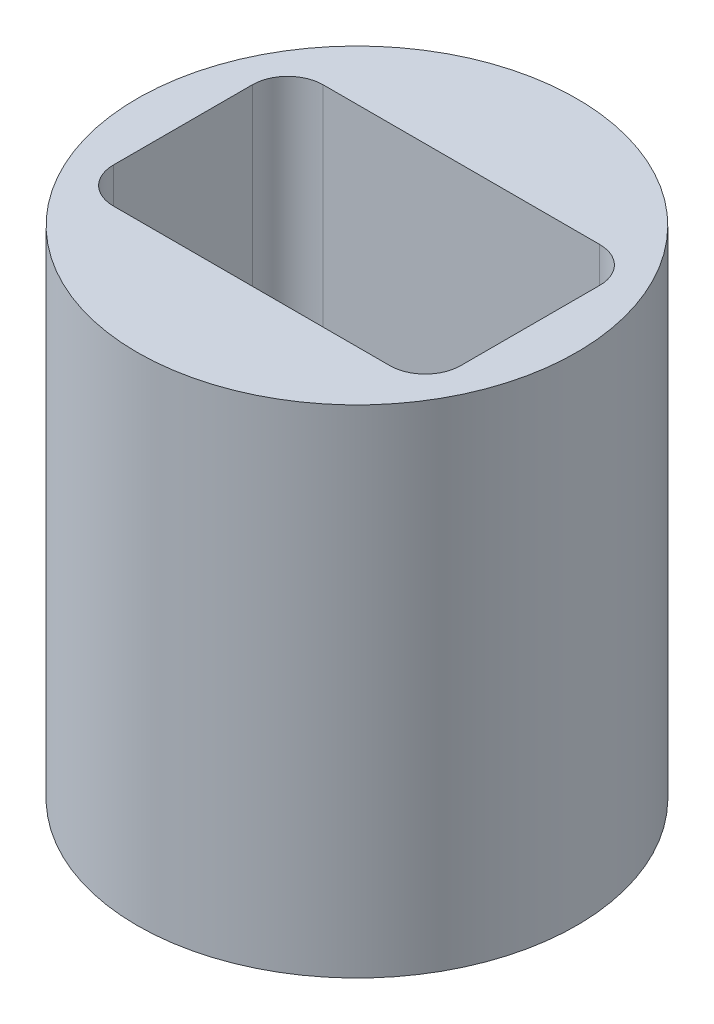
from build123d import *

# Parameters (mm, degrees)
ESBO_O1_R                = 3.1
RESSALTO_EXTRUS_O1_DEPTH = 7
CORTE_EXTRUS_O1_DEPTH    = 9.259539939


with BuildPart() as part:
    # Esboço1 → Ressalto-extrusão1 (new body)
    with BuildSketch(Plane(origin=(0, 0, 0), x_dir=(1, 0, 0), z_dir=(0, 1, 0))):
        with Locations(Location((0, 0, 0), (0, 0, 270))):
            Circle(ESBO_O1_R)
    extrude(amount=RESSALTO_EXTRUS_O1_DEPTH)

    # Esboço2 → Corte-extrusão1 (cut, through all)
    with BuildSketch(Plane(origin=(0, 7, 0), x_dir=(1, 0, 0), z_dir=(0, 1, 0))):
        with BuildLine():
            Line((-1.956270364, -1.48), (1.943729636, -1.48))
            ThreePointArc((1.943729636, -1.48), (2.297283026, -1.333553391), (2.443729636, -0.98))
            Line((2.443729636, -0.98), (2.443729636, 0.98))
            ThreePointArc((2.443729636, 0.98), (2.297283026, 1.333553391), (1.943729636, 1.48))
            Line((1.943729636, 1.48), (-1.956270364, 1.48))
            ThreePointArc((-1.956270364, 1.48), (-2.309823755, 1.333553391), (-2.456270364, 0.98))
            Line((-2.456270364, 0.98), (-2.456270364, -0.98))
            ThreePointArc((-2.456270364, -0.98), (-2.309823755, -1.333553391), (-1.956270364, -1.48))
        make_face()
    extrude(amount=-CORTE_EXTRUS_O1_DEPTH, mode=Mode.SUBTRACT)


solid = part.part
